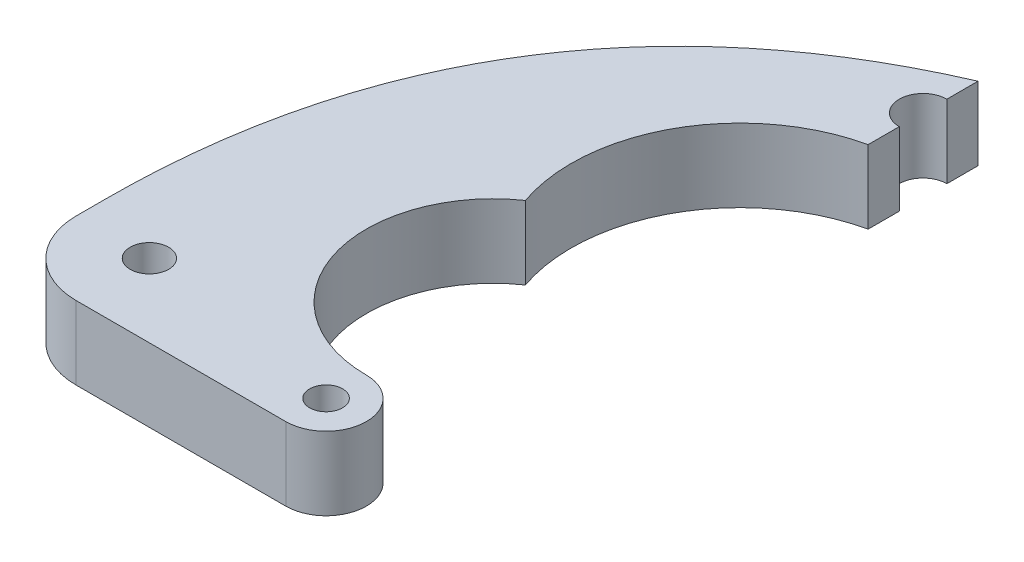
from build123d import *

# Parameters (mm, degrees)
SKETCH1_R           = 0.9
SKETCH1_R_2         = 1.05
BOSS_EXTRUDE2_DEPTH = 4


with BuildPart() as part:
    # Sketch1 → Boss-Extrude2 (new body)
    with BuildSketch(Plane(origin=(0, 0, 0), x_dir=(1, 0, 0), z_dir=(0, 1, 0))):
        with BuildLine():
            Line((0, 51.3), (0, 53))
            add(Edge.make_bspline(
                [(0, 53), (-11.288586004, 48.107069446), (-18.25, 38.69126661), (-18.25, 23.6)],
                knots=[0, 0, 0, 0, 1, 1, 1, 1], degree=3))
            Line((-18.25, 23.6), (-18.25, 22))
            ThreePointArc((-18.25, 22), (-17.078427125, 19.171572875), (-14.25, 18))
            Line((-14.25, 18), (-2.8, 18))
            ThreePointArc((-2.8, 18), (-0.6, 20.2), (-2.8, 22.4))
            ThreePointArc((-2.8, 22.4), (-9.397521131, 27.257683793), (-6.717797887, 35))
            ThreePointArc((-6.717797887, 35), (-6.044737279, 42.503576591), (0, 47))
            Line((0, 47), (0, 48.7))
            ThreePointArc((0, 48.7), (-1.3, 50), (0, 51.3))
        make_face()
        with Locations(Location((-2.8, 20.2, 0), (0, 0, 270))):
            Circle(SKETCH1_R, mode=Mode.SUBTRACT)
        with Locations(Location((-14.25, 22, 0), (0, 0, 270))):
            Circle(SKETCH1_R_2, mode=Mode.SUBTRACT)
    extrude(amount=BOSS_EXTRUDE2_DEPTH)


solid = part.part
